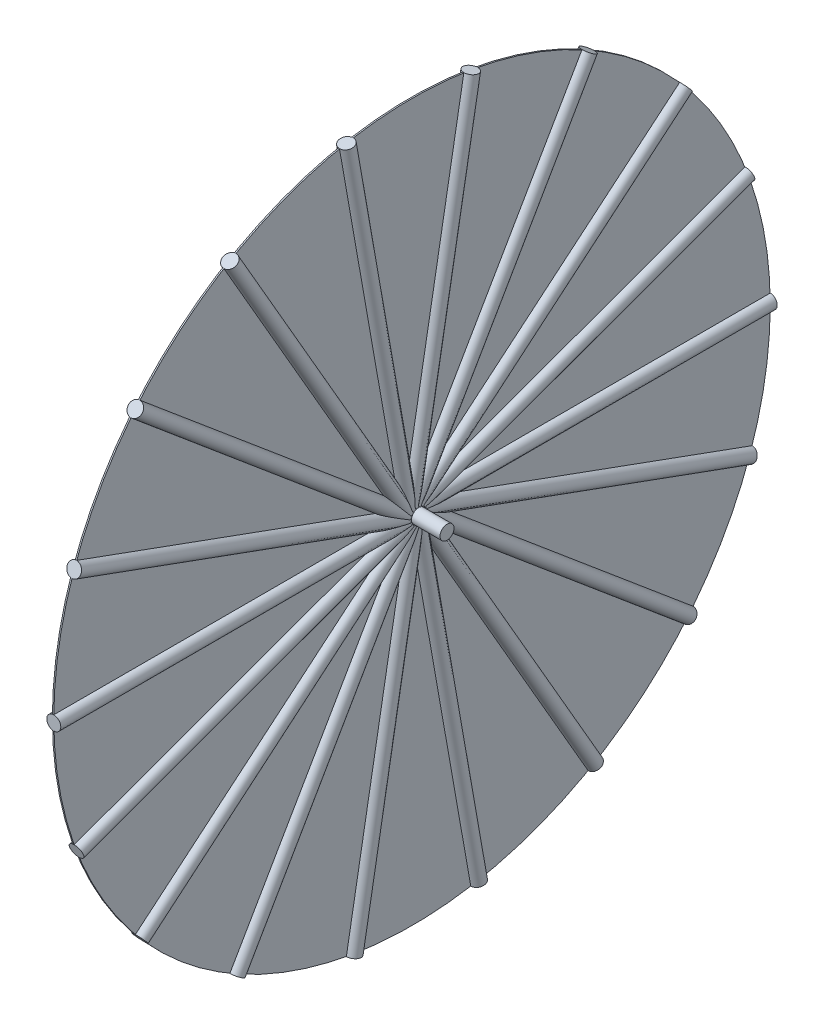
from build123d import *

# Parameters (mm, degrees)
SKETCH3_W           = 127.046882492
SKETCH3_H           = 25.4
SKETCH6_W           = 1274.6
SKETCH6_H           = 25.4
SKETCH7_R           = 1300
BOSS_EXTRUDE2_DEPTH = 5.08
CIRPATTERN1_COUNT   = 18


with BuildPart() as part:
    # Sketch3 → Revolve2 (revolve)
    with BuildSketch(Plane(origin=(39.784286719, 0, 0), x_dir=(1, 0, 0), z_dir=(0, 0, 1)), mode=Mode.PRIVATE) as revolve2_sk:
        with Locations((63.523441246, 12.7)):
            Rectangle(SKETCH3_W, SKETCH3_H)
    revolve(revolve2_sk.sketch.rotate(Axis((39.784286719, 0, 0), (1, 0, 0)), 90), axis=Axis((39.784286719, 0, 0), (1, 0, 0)))

    # Sketch7 → Boss-Extrude2 (add)
    with BuildSketch(Plane.ZY.offset(-39.784286719)):
        Circle(SKETCH7_R)
    extrude(amount=BOSS_EXTRUDE2_DEPTH)


with BuildPart() as body_2:
    # Sketch6 → Revolve3 (revolve)
    with BuildSketch(Plane.ZY.offset(-39.784286719), mode=Mode.PRIVATE) as revolve3_sk:
        with Locations((662.7, 0)):
            Rectangle(SKETCH6_W, SKETCH6_H)
    revolve3 = revolve(revolve3_sk.sketch.rotate(Axis((39.784286719, -12.7, 25.4), (0, 0, 1)), 90), axis=Axis((39.784286719, -12.7, 25.4), (0, 0, 1)))

    # CirPattern1: Revolve3 ×18 about axis
    cirpattern1_axis = Axis((0, 0, 0), (1, 0, 0))
    for i in range(1, CIRPATTERN1_COUNT):
        add(revolve3.rotate(cirpattern1_axis, i * 360 / CIRPATTERN1_COUNT))


solid = Compound([part.part, body_2.part])
